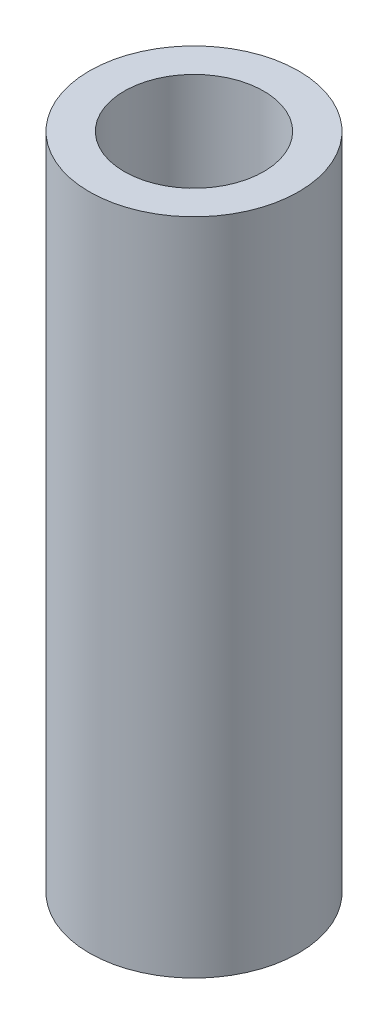
from build123d import *

# Parameters (mm, degrees)
SKETCH1_R           = 4.7625
SKETCH1_R_2         = 3.175
BOSS_EXTRUDE1_DEPTH = 30


with BuildPart() as part:
    # Sketch1 → Boss-Extrude1 (new body)
    with BuildSketch(Plane(origin=(0, 0, 0), x_dir=(1, 0, 0), z_dir=(0, 1, 0))):
        with Locations(Location((0, 0, 0), (0, 0, 270))):
            Circle(SKETCH1_R)
        with Locations(Location((0, 0, 0), (0, 0, 270))):
            Circle(SKETCH1_R_2, mode=Mode.SUBTRACT)
    extrude(amount=BOSS_EXTRUDE1_DEPTH)


solid = part.part
